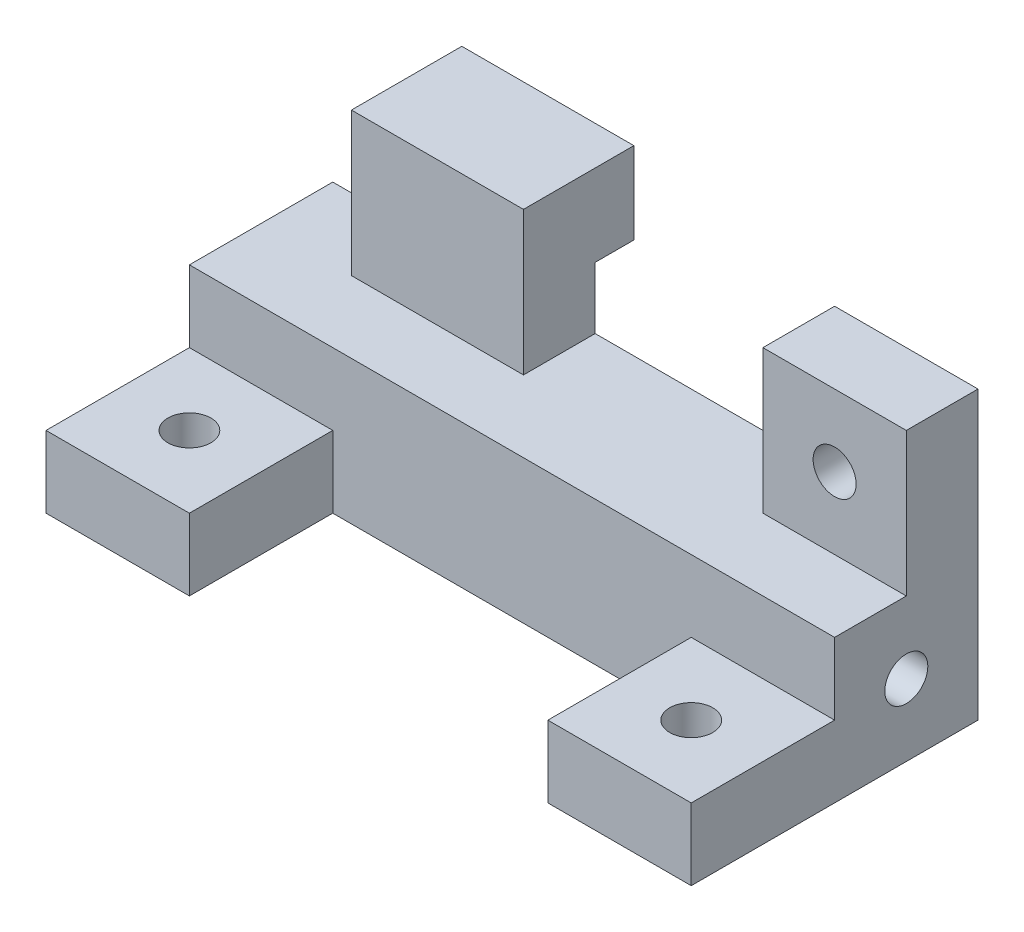
from build123d import *

# Parameters (mm, degrees)
SKETCH1_W           = 45
SKETCH1_H           = 10
BOSS_EXTRUDE1_DEPTH = 10
SKETCH2_W           = 10
SKETCH2_H           = 5
SKETCH2_W_2         = 12
BOSS_EXTRUDE2_DEPTH = 10
SKETCH3_W           = 10
SKETCH3_H           = 5
BOSS_EXTRUDE3_DEPTH = 10
SKETCH4_R           = 1.5
CUT_EXTRUDE1_DEPTH  = 5
SKETCH6_R           = 1.5
CUT_EXTRUDE3_DEPTH  = 5
CUT_EXTRUDE4_START  = -5
SKETCH7_R           = 1.5
CUT_EXTRUDE4_DEPTH  = 5
SKETCH9_R           = 1.5
CUT_EXTRUDE6_DEPTH  = 5
SKETCH10_R          = 1.5
CUT_EXTRUDE7_DEPTH  = 5
SKETCH11_W          = 12
SKETCH11_H          = 5.7
BOSS_EXTRUDE4_DEPTH = 2.7


with BuildPart() as part:
    # Sketch1 → Boss-Extrude1 (new body)
    with BuildSketch(Plane.XY):
        with Locations((22.5, 5)):
            Rectangle(SKETCH1_W, SKETCH1_H)
    extrude(amount=BOSS_EXTRUDE1_DEPTH)

    # Sketch2 → Boss-Extrude2 (add)
    with BuildSketch(Plane(origin=(0, 10, 0), x_dir=(1, 0, 0), z_dir=(0, 1, 0))):
        with Locations((40, -2.5)):
            Rectangle(SKETCH2_W, SKETCH2_H)
        with Locations((12.3, -2.5)):
            Rectangle(SKETCH2_W_2, SKETCH2_H)
    extrude(amount=BOSS_EXTRUDE2_DEPTH)

    # Sketch3 → Boss-Extrude3 (add)
    with BuildSketch(Plane.XY.offset(10)):
        with Locations((5, 2.5)):
            Rectangle(SKETCH3_W, SKETCH3_H)
        with Locations((40, 2.5)):
            Rectangle(SKETCH3_W, SKETCH3_H)
    extrude(amount=BOSS_EXTRUDE3_DEPTH)

    # Sketch4 → Cut-Extrude1 (cut)
    with BuildSketch(Plane.ZY):
        with Locations((5, 5)):
            Circle(SKETCH4_R)
    extrude(amount=-CUT_EXTRUDE1_DEPTH, mode=Mode.SUBTRACT)

    # Sketch6 → Cut-Extrude3 (cut)
    with BuildSketch(Plane(origin=(0, 5, 0), x_dir=(1, 0, 0), z_dir=(0, 1, 0))):
        with Locations(Location((5, -15, 0), (0, 0, 270))):
            Circle(SKETCH6_R)
    extrude(amount=-CUT_EXTRUDE3_DEPTH, mode=Mode.SUBTRACT)

    # Sketch7 → Cut-Extrude4 (cut)
    with BuildSketch(Plane(origin=(45, 0, 0), x_dir=(0, 0, -1), z_dir=(1, 0, 0)).offset(CUT_EXTRUDE4_START)):
        with Locations(Location((-5, 5, 0), (0, 0, 180))):
            Circle(SKETCH7_R)
    extrude(amount=CUT_EXTRUDE4_DEPTH, mode=Mode.SUBTRACT)

    # Sketch9 → Cut-Extrude6 (cut)
    with BuildSketch(Plane(origin=(0, 5, 0), x_dir=(1, 0, 0), z_dir=(0, 1, 0))):
        with Locations(Location((40, -15, 0), (0, 0, 180))):
            Circle(SKETCH9_R)
    extrude(amount=-CUT_EXTRUDE6_DEPTH, mode=Mode.SUBTRACT)

    # Sketch10 → Cut-Extrude7 (cut)
    with BuildSketch(Plane.XY.offset(5)):
        with Locations((40, 15)):
            Circle(SKETCH10_R)
    extrude(amount=-CUT_EXTRUDE7_DEPTH, mode=Mode.SUBTRACT)

    # Sketch11 → Boss-Extrude4 (add)
    with BuildSketch(Plane(origin=(0, 0, 0), x_dir=(-1, 0, 0), z_dir=(0, 0, -1))):
        with Locations((-12.3, 17.15)):
            Rectangle(SKETCH11_W, SKETCH11_H)
    extrude(amount=BOSS_EXTRUDE4_DEPTH)


solid = part.part
